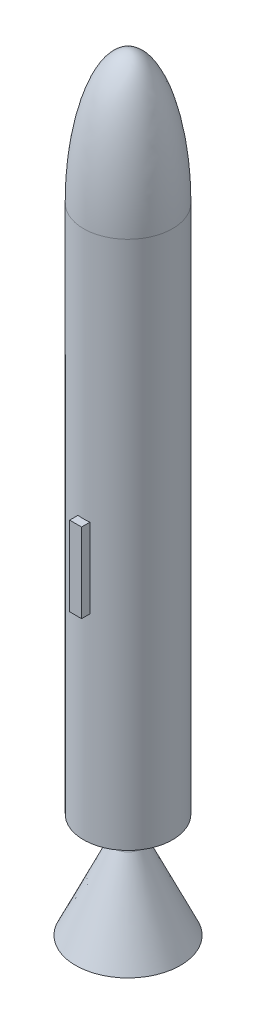
from build123d import *

# Parameters (mm, degrees)
SKETCH1_W           = 56
SKETCH1_H           = 666.6
DOME1_FACE_RADIUS   = 56
DOME1_HEIGHT        = 166.665
SKETCH3_W           = 15
SKETCH3_H           = 100
BOSS_EXTRUDE1_DEPTH = 66


with BuildPart() as part:
    # Sketch1 → Revolve1 (revolve)
    with BuildSketch(Plane.XY):
        with Locations((28, -333.3)):
            Rectangle(SKETCH1_W, SKETCH1_H)
    revolve(axis=Axis((0, 0, 0), (0, -1, 0)))

    # Dome1: an elliptical dome of height H over a round flat face of radius A is half a spheroid: the quarter ellipse of half axes A and H revolved about the face's axis
    with BuildSketch(Plane((0, 0, 0), x_dir=(0, 0, -1), z_dir=(1, 0, 0)), mode=Mode.PRIVATE) as dome1_quarter:
        Ellipse(DOME1_FACE_RADIUS, DOME1_HEIGHT)
        Rectangle(DOME1_FACE_RADIUS, DOME1_HEIGHT, align=(Align.MIN, Align.MIN), mode=Mode.INTERSECT)
    revolve(dome1_quarter.sketch, axis=Axis((0, 0, 0), (0, 1, 0)))

    # Sketch2 → Revolve2 (revolve)
    with BuildSketch(Plane.XY):
        with BuildLine():
            Line((19.405267456, -666.6), (19.019237886, -667.268622827))
            ThreePointArc((19.019237886, -667.268622827), (16.022225211, -674.504051474), (15, -682.268622827))
            Line((15, -682.268622827), (15, -682.579307175))
            ThreePointArc((15, -682.579307175), (15.711119786, -689.072495593), (17.810766389, -695.257855027))
            Line((17.810766389, -695.257855027), (66, -798.6))
            Line((66, -798.6), (0, -798.6))
            Line((0, -798.6), (0, -666.6))
            Line((0, -666.6), (19.405267456, -666.6))
        make_face()
    revolve(axis=Axis((0, -1354.267338739, 0), (0, 1, 0)))

    # Sketch3 → Boss-Extrude1 (add)
    with BuildSketch(Plane.XY):
        with Locations((0, -366.6)):
            Rectangle(SKETCH3_W, SKETCH3_H)
    extrude(amount=BOSS_EXTRUDE1_DEPTH)


solid = part.part
